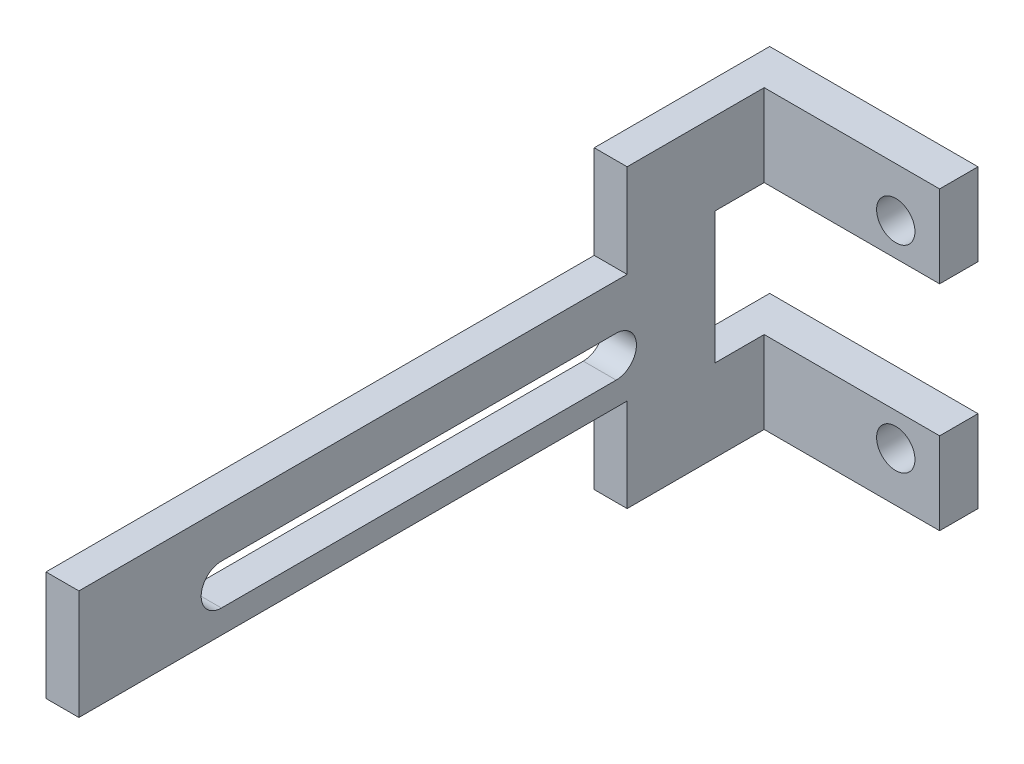
from build123d import *

# Parameters (mm, degrees)
BOSS_EXTRUDE1_DEPTH = 3
SKETCH3_W           = 27
SKETCH3_H           = 3.5
BOSS_EXTRUDE2_DEPTH = 16
SKETCH4_R           = 1.75
CUT_EXTRUDE1_DEPTH  = 10
SKETCH5_W           = 12
SKETCH5_H           = 8
CUT_EXTRUDE2_DEPTH  = 21


with BuildPart() as part:
    # Sketch2 → Boss-Extrude1 (new body)
    with BuildSketch(Plane.YZ):
        Polygon((-5, 66), (5, 66), (5, 16), (13.5, 16), (13.5, 0), (-13.5, 0), (-13.5, 16), (-5, 16), align=None)
        with BuildLine():
            Line((0.85, 53), (0.85, 17))
            ThreePointArc((0.85, 17), (-1, 15.15), (-2.85, 17))
            Line((-2.85, 17), (-2.85, 53))
            ThreePointArc((-2.85, 53), (-1, 54.85), (0.85, 53))
        make_face(mode=Mode.SUBTRACT)
    extrude(amount=BOSS_EXTRUDE1_DEPTH)

    # Sketch3 → Boss-Extrude2 (add)
    with BuildSketch(Plane.YZ.offset(3)):
        with Locations((0, 1.75)):
            Rectangle(SKETCH3_W, SKETCH3_H)
    extrude(amount=BOSS_EXTRUDE2_DEPTH)

    # Sketch4 → Cut-Extrude1 (cut)
    with BuildSketch(Plane.XY.offset(3.5)):
        with Locations((15, 9)):
            Circle(SKETCH4_R)
        with Locations((15, -9)):
            Circle(SKETCH4_R)
    extrude(amount=-CUT_EXTRUDE1_DEPTH, mode=Mode.SUBTRACT)

    # Sketch5 → Cut-Extrude2 (cut)
    with BuildSketch(Plane.YZ.offset(19)):
        with Locations((0, 4)):
            Rectangle(SKETCH5_W, SKETCH5_H)
    extrude(amount=-CUT_EXTRUDE2_DEPTH, mode=Mode.SUBTRACT)


solid = part.part
